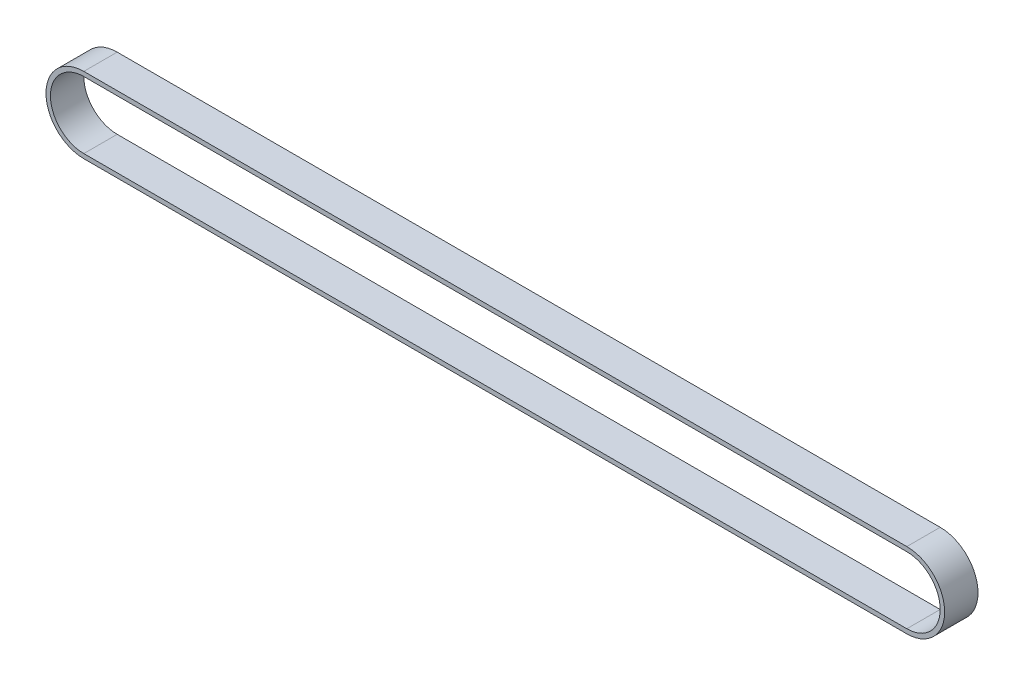
from build123d import *

# Parameters (mm, degrees)
EXTRUDE_3_DEPTH = 15


with BuildPart() as part:
    # 스케치1 → 보스-돌출3 (new body)
    with BuildSketch(Plane.XY):
        with BuildLine():
            ThreePointArc((370, -17), (387, 0), (370, 17))
            Line((370, 17), (0, 17))
            ThreePointArc((0, 17), (-17, 0), (0, -17))
            Line((0, -17), (370, -17))
        make_face()
        with BuildLine():
            ThreePointArc((0, -15), (-15, 0), (0, 15))
            Line((0, 15), (370, 15))
            ThreePointArc((370, 15), (385, 0), (370, -15))
            Line((370, -15), (0, -15))
        make_face(mode=Mode.SUBTRACT)
    extrude(amount=EXTRUDE_3_DEPTH)


solid = part.part
